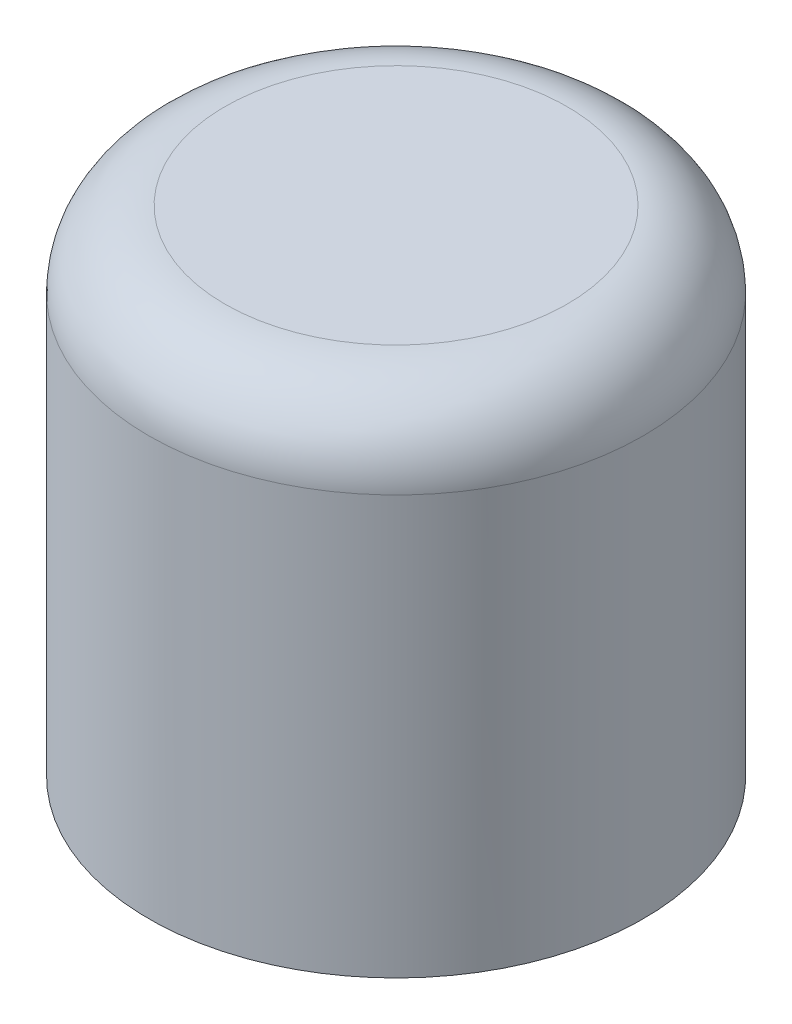
from build123d import *

# Parameters (mm, degrees)
SKETCH1_R           = 6.5
BOSS_EXTRUDE1_DEPTH = 13
FILLET1_R           = 2


with BuildPart() as part:
    # Sketch1 → Boss-Extrude1 (new body)
    with BuildSketch(Plane(origin=(0, 0, 0), x_dir=(1, 0, 0), z_dir=(0, 1, 0))):
        with Locations(Location((0, 0, 0), (0, 0, 90))):
            Circle(SKETCH1_R)
    extrude(amount=BOSS_EXTRUDE1_DEPTH)

    # Fillet1
    fillet1_edges = [part.edges().sort_by_distance(p)[0] for p in [
        (0, 13, 6.5),
    ]]
    fillet(fillet1_edges, radius=FILLET1_R)


solid = part.part
